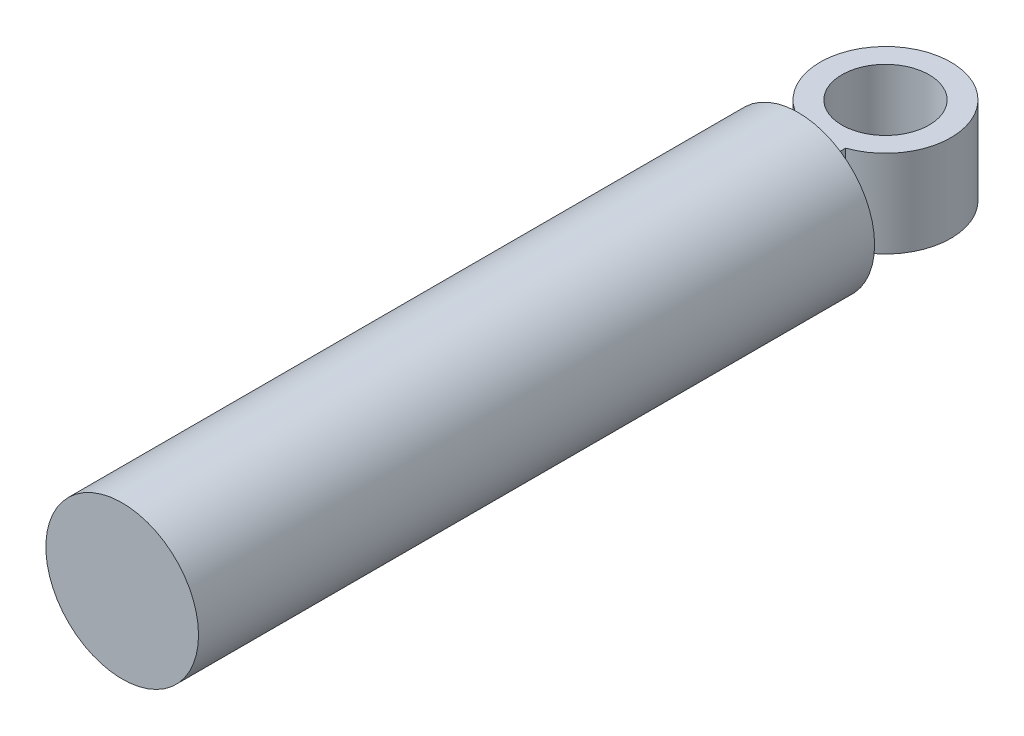
from build123d import *

# Parameters (mm, degrees)
IZIM1_R                     = 35
Y_KSEKLIK_EKSTR_ZYON1_DEPTH = 310
IZIM2_R                     = 20
Y_KSEKLIK_EKSTR_ZYON2_DEPTH = 20


with BuildPart() as part:
    # Çizim1 → Yükseklik-Ekstrüzyon1 (new body)
    with BuildSketch(Plane.XY):
        Circle(IZIM1_R)
    extrude(amount=Y_KSEKLIK_EKSTR_ZYON1_DEPTH)

    # Çizim2 → Yükseklik-Ekstrüzyon2 (add, symmetric)
    with BuildSketch(Plane(origin=(0, 0, 0), x_dir=(1, 0, 0), z_dir=(0, 1, 0))):
        with BuildLine():
            Line((-10, 0), (-10, 11.715728753))
            ThreePointArc((-10, 11.715728753), (0, 70), (10, 11.715728753))
            Line((10, 11.715728753), (10, 0))
            Line((10, 0), (-10, 0))
        make_face()
        with Locations(Location((0, 40, 0), (0, 0, 270))):
            Circle(IZIM2_R, mode=Mode.SUBTRACT)
    extrude(amount=Y_KSEKLIK_EKSTR_ZYON2_DEPTH, both=True)


solid = part.part
